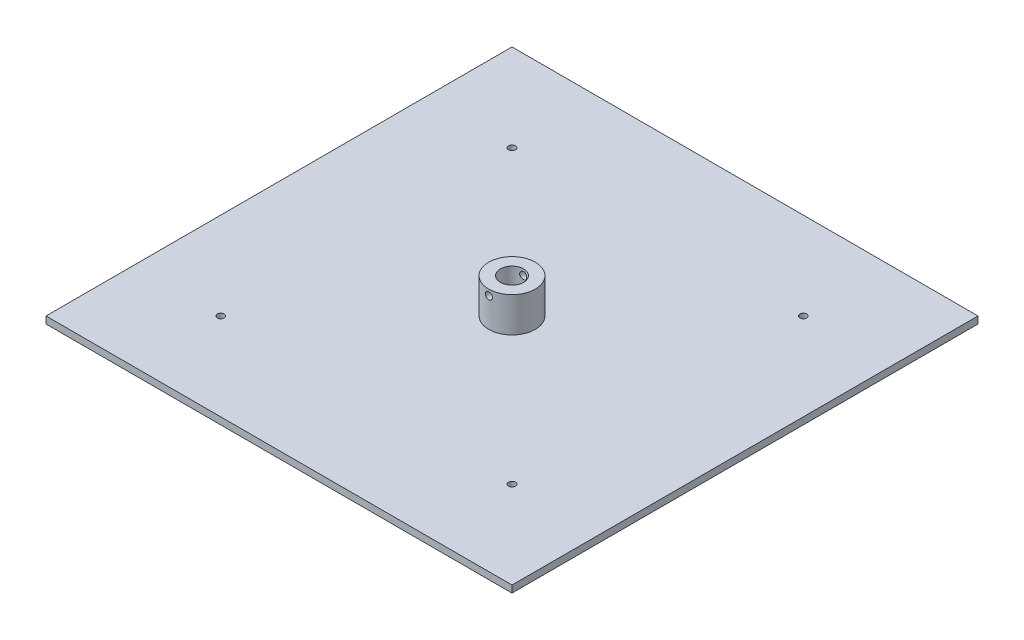
from build123d import *

# Parameters (mm, degrees)
SKETCH_1_W          = 400
SKETCH_1_H          = 400
SKETCH_1_R          = 3
EXTRUDE_1_DEPTH     = 6
SKETCH_2_R          = 20
EXTRUDE_2_DEPTH     = 30
SKETCH_3_R          = 10
CUT_EXTRUDE_1_DEPTH = 286.124534195
SKETCH_4_R          = 3
CUT_EXTRUDE_2_DEPTH = 300.492904757


with BuildPart() as part:
    # 草图1 → 凸台-拉伸1 (new body)
    with BuildSketch(Plane(origin=(0, 0, 0), x_dir=(1, 0, 0), z_dir=(0, 1, 0))):
        Rectangle(SKETCH_1_W, SKETCH_1_H)
        with Locations(Location((-125, 125, 0), (0, 0, 270))):
            Circle(SKETCH_1_R, mode=Mode.SUBTRACT)
        with Locations(Location((125, 125, 0), (0, 0, 270))):
            Circle(SKETCH_1_R, mode=Mode.SUBTRACT)
        with Locations(Location((125, -125, 0), (0, 0, 270))):
            Circle(SKETCH_1_R, mode=Mode.SUBTRACT)
        with Locations(Location((-125, -125, 0), (0, 0, 270))):
            Circle(SKETCH_1_R, mode=Mode.SUBTRACT)
    extrude(amount=EXTRUDE_1_DEPTH)

    # 草图2 → 凸台-拉伸2 (add)
    with BuildSketch(Plane(origin=(0, 6, 0), x_dir=(1, 0, 0), z_dir=(0, 1, 0))):
        with Locations(Location((0, 0, 0), (0, 0, 270))):
            Circle(SKETCH_2_R)
    extrude(amount=EXTRUDE_2_DEPTH)

    # 草图3 → 切除-拉伸1 (cut, through all)
    with BuildSketch(Plane(origin=(0, 36, 0), x_dir=(1, 0, 0), z_dir=(0, 1, 0))):
        with Locations(Location((0, 0, 0), (0, 0, 270))):
            Circle(SKETCH_3_R)
    extrude(amount=-CUT_EXTRUDE_1_DEPTH, mode=Mode.SUBTRACT)

    # 草图4 → 切除-拉伸2 (cut, through all)
    with BuildSketch(Plane(origin=(0, 0, -20), x_dir=(-1, 0, 0), z_dir=(0, 0, -1))):
        with Locations((0, 31)):
            Circle(SKETCH_4_R)
    extrude(amount=-CUT_EXTRUDE_2_DEPTH, mode=Mode.SUBTRACT)


solid = part.part
